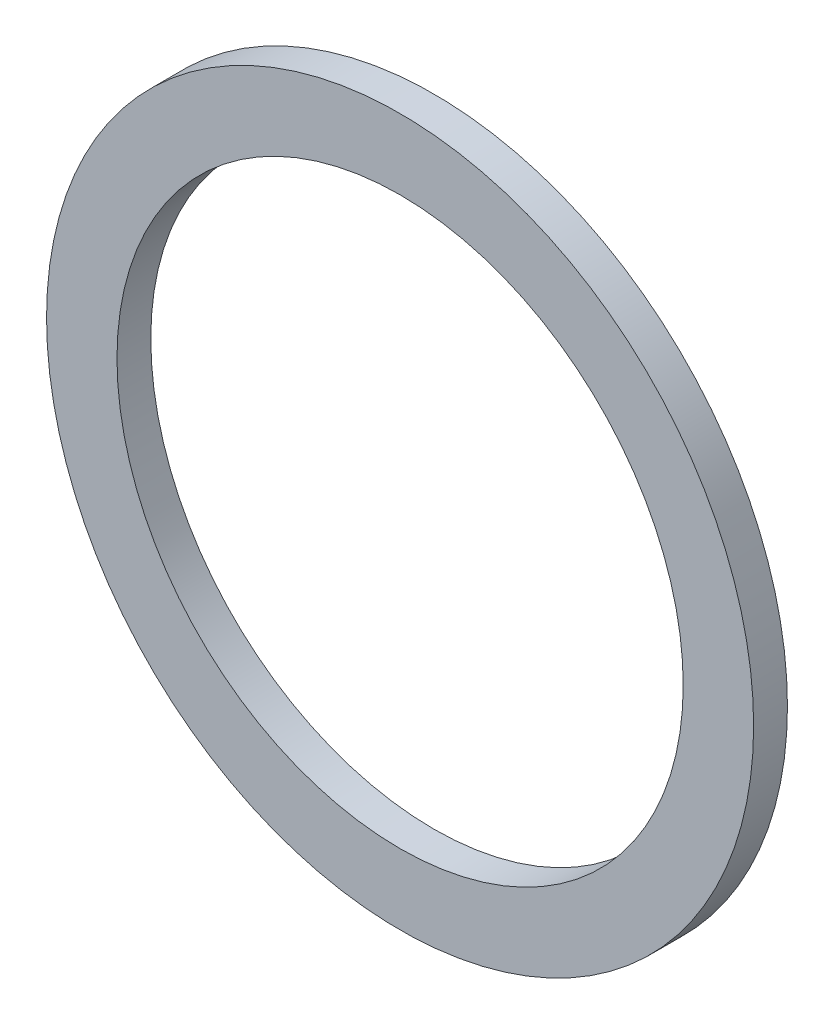
from build123d import *

# Parameters (mm, degrees)
SKETCH1_R           = 31.877
SKETCH1_R_2         = 25.527
BOSS_EXTRUDE1_DEPTH = 3.048


with BuildPart() as part:
    # Sketch1 → Boss-Extrude1 (new body)
    with BuildSketch(Plane.XY):
        with Locations(Location((0, 0, 0), (0, 0, 180))):
            Circle(SKETCH1_R)
        with Locations(Location((0, 0, 0), (0, 0, 180))):
            Circle(SKETCH1_R_2, mode=Mode.SUBTRACT)
    extrude(amount=BOSS_EXTRUDE1_DEPTH)


solid = part.part
